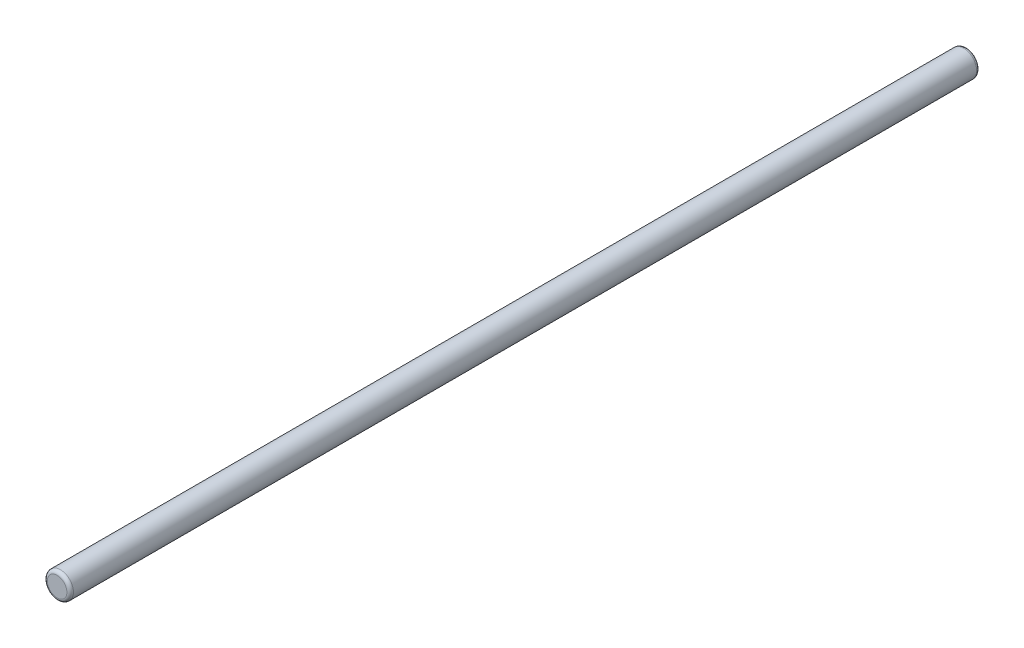
from build123d import *

# Parameters (mm, degrees)
SKETCH1_R           = 1.00457
BOSS_EXTRUDE1_DEPTH = 69.977
FILLET1_R           = 0.254


with BuildPart() as part:
    # Sketch1 → Boss-Extrude1 (new body)
    with BuildSketch(Plane.XY):
        Circle(SKETCH1_R)
    extrude(amount=BOSS_EXTRUDE1_DEPTH)

    # Fillet1
    fillet1_edges = [part.edges().sort_by_distance(p)[0] for p in [
        (-1.00457, 0, 0),
        (-1.00457, 0, 69.977),
    ]]
    fillet(fillet1_edges, radius=FILLET1_R)


solid = part.part
